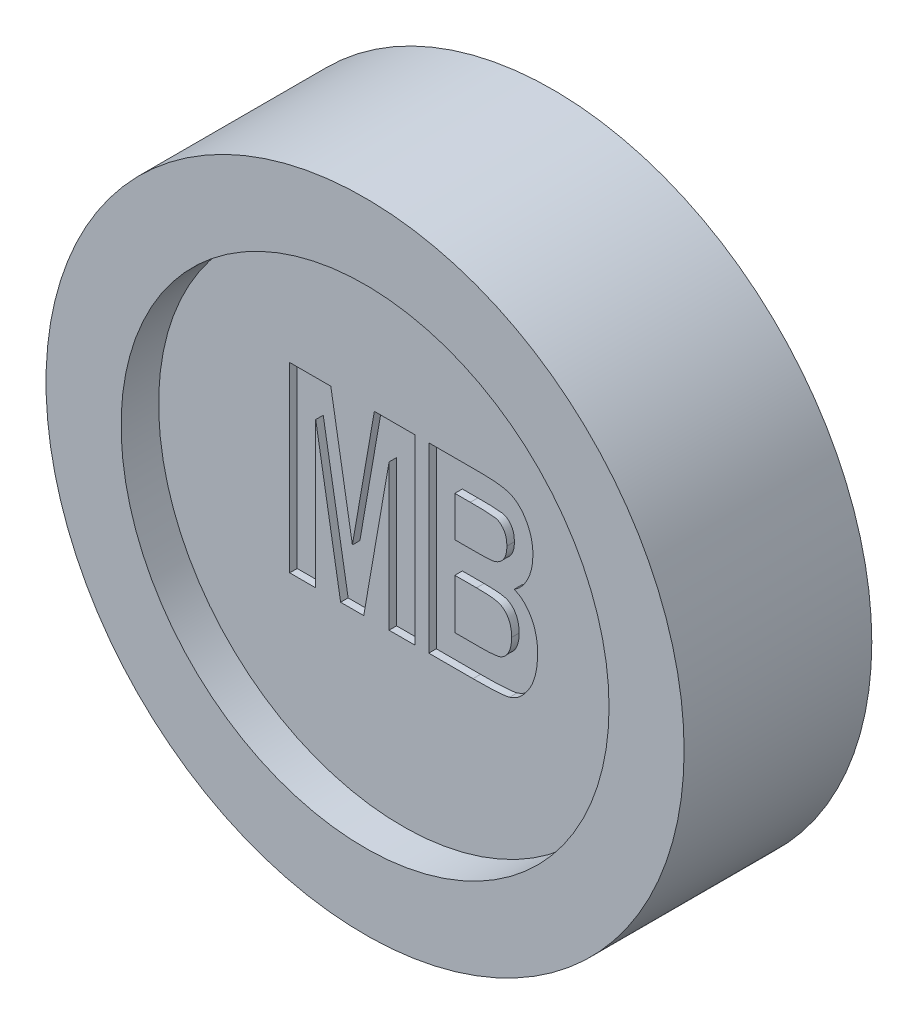
from build123d import *

# Parameters (mm, degrees)
SKETCH1_R           = 10.795
BOSS_EXTRUDE1_DEPTH = 6.35
SKETCH3_R           = 8.255
CUT_EXTRUDE1_DEPTH  = 1.27
CUT_EXTRUDE2_START  = -1.27
SKETCH4_R           = 8.255
CUT_EXTRUDE2_DEPTH  = 1.27
CUT_EXTRUDE3_DEPTH  = 0.254
CUT_EXTRUDE4_DEPTH  = 0.254
CUT_EXTRUDE5_DEPTH  = 0.254


with BuildPart() as part:
    # Sketch1 → Boss-Extrude1 (new body)
    with BuildSketch(Plane.XY):
        Circle(SKETCH1_R)
    extrude(amount=BOSS_EXTRUDE1_DEPTH)

    # Sketch3 → Cut-Extrude1 (cut)
    with BuildSketch(Plane.XY.offset(6.35)):
        Circle(SKETCH3_R)
    extrude(amount=-CUT_EXTRUDE1_DEPTH, mode=Mode.SUBTRACT)

    # Sketch4 → Cut-Extrude2 (cut)
    with BuildSketch(Plane(origin=(0, 0, 0), x_dir=(-1, 0, 0), z_dir=(0, 0, -1)).offset(CUT_EXTRUDE2_START)):
        with Locations(Location((0, 0, 0), (0, 0, 180))):
            Circle(SKETCH4_R)
    extrude(amount=CUT_EXTRUDE2_DEPTH, mode=Mode.SUBTRACT)

    # Sketch6 → Cut-Extrude3 (cut)
    # profile 1 of 2: a face of its own
    with BuildSketch(Plane.XY.offset(5.08)):
        Polygon((-3.820426287, -2.738134767), (-3.820426287, 3.425830077), (-2.429531623, 3.425830077), (-1.699061763, -0.859426326), (-0.956083858, 3.425830077), (0.422302761, 3.425830077), (0.422302761, -2.738134767), (-0.458263645, -2.738134767), (-0.458263645, 2.193787591), (-1.315064765, -2.738134767), (-2.096817611, -2.738134767), (-2.939859881, 2.193787591), (-2.939859881, -2.738134767), align=None)
    # profile 2 of 2: a face of its own
    with BuildSketch(Plane.XY.offset(5.08)):
        with BuildLine():
            Line((0.886601412, 3.425830077), (2.67400112, 3.425830077))
            add(Edge.make_bspline(
                [(2.67400112, 3.425830077), (2.732790269, 3.425222307), (2.845816799, 3.424053823), (3.008608251, 3.418759077), (3.157489236, 3.405767508), (3.292663768, 3.389668698), (3.414952449, 3.37065086), (3.523013921, 3.344272962), (3.618290449, 3.314681966), (3.727264663, 3.267991241), (3.85004685, 3.190422365), (3.982037051, 3.070723052), (4.10353071, 2.923641739), (4.208021503, 2.749583898), (4.299366262, 2.557436952), (4.361825053, 2.34817807), (4.402599544, 2.127000115), (4.406745433, 1.975086616), (4.408867037, 1.897346911)],
                knots=[0, 0, 0, 0, 1.056630108, 2.031450314, 2.926269266, 3.741363116, 4.47801298, 5.148632888, 5.738685924, 6.269003108, 7.275337549, 8.33132982, 9.459579192, 10.690726142, 11.971340976, 13.272571529, 14.604274901, 16, 16, 16, 16], degree=3))
            add(Edge.make_bspline(
                [(4.408867037, 1.897346911), (4.406663524, 1.825931891), (4.402335972, 1.685677612), (4.369489323, 1.480662376), (4.313978496, 1.286434243), (4.238374963, 1.105090113), (4.145432549, 0.940084936), (4.03708975, 0.796643491), (3.917277387, 0.672986409), (3.824277177, 0.610857104), (3.778461541, 0.580249716)],
                knots=[0, 0, 0, 0, 1.125723716, 2.210845361, 3.263765995, 4.303988308, 5.302058453, 6.240840838, 7.133367609, 8, 8, 8, 8], degree=3))
            add(Edge.make_bspline(
                [(3.778461541, 0.580249716), (3.838036291, 0.550581528), (3.957244452, 0.491215938), (4.115565373, 0.364834606), (4.249971486, 0.207534122), (4.365218869, 0.02529818), (4.458171491, -0.181603408), (4.521879622, -0.412343328), (4.563137981, -0.663235801), (4.566984104, -0.837988407), (4.56897002, -0.928220577)],
                knots=[0, 0, 0, 0, 0.883520627, 1.767911254, 2.672114911, 3.624549442, 4.627514094, 5.677337842, 6.80071118, 8, 8, 8, 8], degree=3))
            add(Edge.make_bspline(
                [(4.56897002, -0.928220577), (4.567801708, -0.98410484), (4.565514494, -1.093509906), (4.553681707, -1.254480975), (4.530265314, -1.408356699), (4.501437446, -1.556278288), (4.460841903, -1.696984384), (4.411747741, -1.83085644), (4.356006324, -1.959510377), (4.289538968, -2.079729075), (4.218036973, -2.191321339), (4.142100743, -2.291887234), (4.065478346, -2.382834837), (3.983005304, -2.460761424), (3.898125001, -2.528900039), (3.809369525, -2.585442707), (3.717145293, -2.629793374), (3.653625036, -2.651210227), (3.622110972, -2.661835689)],
                knots=[0, 0, 0, 0, 1.274453675, 2.495008106, 3.676776175, 4.82152406, 5.928871144, 7.011540481, 8.071389355, 9.122203498, 10.140077302, 11.090738677, 11.994017075, 12.847973492, 13.673462932, 14.472584156, 15.242208981, 16, 16, 16, 16], degree=3))
            add(Edge.make_bspline(
                [(3.622110972, -2.661835689), (3.596322402, -2.667963688), (3.537649713, -2.681905764), (3.437406333, -2.697750359), (3.314933526, -2.708868242), (3.171166685, -2.721013623), (3.005068264, -2.727207615), (2.817056551, -2.733959249), (2.606886823, -2.737455325), (2.459697318, -2.73790114), (2.382563659, -2.738134767)],
                knots=[0, 0, 0, 0, 0.51118732, 1.16302434, 1.955278967, 2.882990915, 3.945692945, 5.160771334, 6.512121516, 8, 8, 8, 8], degree=3))
            Line((2.382563659, -2.738134767), (0.886601412, -2.738134767))
            Line((0.886601412, -2.738134767), (0.886601412, 3.425830077))
        make_face()
        with BuildLine():
            Line((1.767167818, 2.385160688), (1.767167818, 1.024285333))
            Line((1.767167818, 1.024285333), (2.3663032, 1.024285333))
            add(Edge.make_bspline(
                [(2.3663032, 1.024285333), (2.40924854, 1.024141085), (2.490555091, 1.023867987), (2.606454485, 1.025690032), (2.709461693, 1.026221836), (2.799494059, 1.029319483), (2.876270327, 1.031068957), (2.940005582, 1.035415268), (2.991437818, 1.038237858), (3.021324154, 1.042470164), (3.034232832, 1.044298205)],
                knots=[0, 0, 0, 0, 1.541550462, 2.918550659, 4.160861091, 5.23886542, 6.152313063, 6.916924473, 7.532191829, 8, 8, 8, 8], degree=3))
            add(Edge.make_bspline(
                [(3.034232832, 1.044298205), (3.071315748, 1.052589669), (3.142882602, 1.068591485), (3.242138852, 1.113663006), (3.327766731, 1.17551248), (3.401125918, 1.253646175), (3.458274682, 1.348348232), (3.50038421, 1.458290205), (3.523147482, 1.583722878), (3.526527576, 1.672115067), (3.52830063, 1.71848186)],
                knots=[0, 0, 0, 0, 0.990046923, 1.910705777, 2.82302627, 3.731768384, 4.689453637, 5.692105556, 6.789376455, 8, 8, 8, 8], degree=3))
            add(Edge.make_bspline(
                [(3.52830063, 1.71848186), (3.527357282, 1.760272037), (3.525561959, 1.839804571), (3.505074611, 1.953061779), (3.471992949, 2.054368097), (3.423968655, 2.141954298), (3.367771673, 2.215654976), (3.306402783, 2.276393969), (3.237426833, 2.319655162), (3.173172862, 2.343887349), (3.110980537, 2.35720939), (3.045930318, 2.36302346), (2.96352265, 2.371613672), (2.863276463, 2.375077281), (2.745777913, 2.381275272), (2.610200937, 2.382389999), (2.456793921, 2.385987475), (2.348378134, 2.385445991), (2.291254926, 2.385160688)],
                knots=[0, 0, 0, 0, 1.212468739, 2.307497077, 3.329948461, 4.294465594, 5.193024313, 6.015226869, 6.787964824, 7.539148066, 7.997555292, 8.631430317, 9.433957082, 10.403932073, 11.543260838, 12.851317538, 14.340990295, 16, 16, 16, 16], degree=3))
            Line((2.291254926, 2.385160688), (1.767167818, 2.385160688))
        make_face(mode=Mode.SUBTRACT)
        with BuildLine():
            Line((1.767167818, -0.016384057), (1.767167818, -1.697465378))
            Line((1.767167818, -1.697465378), (2.607708479, -1.697465378))
            add(Edge.make_bspline(
                [(2.607708479, -1.697465378), (2.6519037, -1.697122127), (2.736131687, -1.696467954), (2.856251359, -1.694389964), (2.963861388, -1.689437362), (3.059034319, -1.682351638), (3.141549224, -1.672038809), (3.211925817, -1.661628408), (3.269535477, -1.64785666), (3.330785254, -1.628449836), (3.396042341, -1.590907708), (3.466422905, -1.53316408), (3.52993218, -1.458478088), (3.585426939, -1.368712796), (3.63205147, -1.264186938), (3.665311934, -1.145883117), (3.685546501, -1.014387801), (3.687423177, -0.92246133), (3.688403613, -0.874435981)],
                knots=[0, 0, 0, 0, 1.320687214, 2.516987601, 3.589599198, 4.539411053, 5.367707727, 6.074351137, 6.663612241, 7.136388901, 7.989518283, 8.892413061, 9.846464441, 10.904285711, 12.036457221, 13.254934037, 14.565889149, 16, 16, 16, 16], degree=3))
            add(Edge.make_bspline(
                [(3.688403613, -0.874435981), (3.687017206, -0.825146726), (3.684359505, -0.730660783), (3.662805998, -0.595903414), (3.628792567, -0.474061071), (3.577803744, -0.36728973), (3.517188766, -0.273805725), (3.444691195, -0.196580193), (3.363794951, -0.133685418), (3.286261549, -0.094970737), (3.215074189, -0.072071588), (3.148812318, -0.057619623), (3.070915976, -0.043487369), (2.98010433, -0.03473373), (2.877639537, -0.024984441), (2.762816516, -0.021334653), (2.635677625, -0.016832014), (2.546842061, -0.01653841), (2.500139287, -0.016384057)],
                knots=[0, 0, 0, 0, 1.373669901, 2.633281717, 3.795906759, 4.888093828, 5.919952209, 6.890587465, 7.827709407, 8.763604513, 9.289363045, 9.909817155, 10.653352002, 11.495593405, 12.452413331, 13.523038871, 14.697808051, 16, 16, 16, 16], degree=3))
            Line((2.500139287, -0.016384057), (1.767167818, -0.016384057))
        make_face(mode=Mode.SUBTRACT)
    extrude(amount=-CUT_EXTRUDE3_DEPTH, mode=Mode.SUBTRACT)

    # Sketch7 → Cut-Extrude4 (cut)
    # profile 1 of 7: a face of its own
    with BuildSketch(Plane(origin=(0, 0, 1.27), x_dir=(-1, 0, 0), z_dir=(0, 0, -1))):
        with BuildLine():
            Line((-4.038542671, 0.668932871), (-3.598259468, 0.485481536))
            add(Edge.make_bspline(
                [(-3.598259468, 0.485481536), (-3.607352571, 0.448471677), (-3.625070932, 0.376356138), (-3.658591631, 0.273282764), (-3.695477329, 0.177646371), (-3.737676639, 0.089982274), (-3.783742764, 0.009521362), (-3.834912856, -0.062944597), (-3.890224198, -0.127786635), (-3.949991386, -0.184853242), (-4.014117491, -0.233954497), (-4.080802019, -0.2777087), (-4.151766959, -0.313577827), (-4.226018611, -0.343863785), (-4.304140728, -0.366376362), (-4.385539757, -0.383318008), (-4.470565082, -0.393012807), (-4.528486875, -0.394386412), (-4.557939262, -0.39508487)],
                knots=[0, 0, 0, 0, 1.282586353, 2.499182829, 3.646034602, 4.730797578, 5.771318175, 6.763713287, 7.712684321, 8.6363956, 9.539720391, 10.428356747, 11.317388874, 12.212151588, 13.124116906, 14.050177375, 15.008543639, 16, 16, 16, 16], degree=3))
            add(Edge.make_bspline(
                [(-4.557939262, -0.39508487), (-4.594893041, -0.394254058), (-4.667284622, -0.392626517), (-4.772917849, -0.375114583), (-4.873436965, -0.34850825), (-4.968660776, -0.310301388), (-5.0587022, -0.261464884), (-5.142610026, -0.200973701), (-5.22234217, -0.131079822), (-5.26870092, -0.076583195), (-5.292317886, -0.048820476)],
                knots=[0, 0, 0, 0, 1.053414494, 2.063614103, 3.046293227, 4.01520277, 4.983805463, 5.961130836, 6.961320097, 8, 8, 8, 8], degree=3))
            add(Edge.make_bspline(
                [(-5.292317886, -0.048820476), (-5.318277676, -0.014543914), (-5.370576074, 0.054509387), (-5.436233808, 0.168378158), (-5.492076972, 0.290711015), (-5.537781847, 0.421618837), (-5.573406388, 0.561246654), (-5.598312568, 0.709661033), (-5.613269488, 0.866790185), (-5.61522433, 0.974460565), (-5.616224149, 1.029529401)],
                knots=[0, 0, 0, 0, 0.898140554, 1.809387162, 2.740718204, 3.705966939, 4.703925369, 5.74945803, 6.848943185, 8, 8, 8, 8], degree=3))
            add(Edge.make_bspline(
                [(-5.616224149, 1.029529401), (-5.615310742, 1.087662341), (-5.613531579, 1.200895555), (-5.59751291, 1.365752351), (-5.573093136, 1.521173073), (-5.536684266, 1.666580048), (-5.491074136, 1.802808214), (-5.434722953, 1.929008071), (-5.369293574, 2.046499476), (-5.315910679, 2.116669307), (-5.289451459, 2.151448969)],
                knots=[0, 0, 0, 0, 1.171098873, 2.281104103, 3.334483992, 4.338438261, 5.297974877, 6.225356982, 7.120398547, 8, 8, 8, 8], degree=3))
            add(Edge.make_bspline(
                [(-5.289451459, 2.151448969), (-5.265427794, 2.179562842), (-5.218082303, 2.234969254), (-5.137157596, 2.306716666), (-5.050219054, 2.367704521), (-4.957298134, 2.417638082), (-4.85797905, 2.456474776), (-4.752747894, 2.483878553), (-4.64118334, 2.500047879), (-4.564872317, 2.502296124), (-4.525835278, 2.503446217)],
                knots=[0, 0, 0, 0, 1.017460211, 2.005195831, 2.96880208, 3.936538458, 4.903086366, 5.898753713, 6.925103759, 8, 8, 8, 8], degree=3))
            add(Edge.make_bspline(
                [(-4.525835278, 2.503446217), (-4.49388874, 2.502681535), (-4.431099318, 2.501178587), (-4.339030015, 2.489163344), (-4.251311369, 2.46803622), (-4.167087117, 2.440324025), (-4.087096199, 2.403245394), (-4.011107318, 2.358252639), (-3.938821645, 2.305493682), (-3.895008156, 2.264478516), (-3.872863184, 2.243747922)],
                knots=[0, 0, 0, 0, 1.062174293, 2.087653736, 3.080296642, 4.058948008, 5.03139012, 6.005719887, 6.992016441, 8, 8, 8, 8], degree=3))
            add(Edge.make_bspline(
                [(-3.872863184, 2.243747922), (-3.857466, 2.227770479), (-3.826090869, 2.195212943), (-3.783844184, 2.140371808), (-3.744731084, 2.079974926), (-3.709452826, 2.013764551), (-3.676655749, 1.942387816), (-3.646832808, 1.865478848), (-3.620596928, 1.78286268), (-3.605820316, 1.725573754), (-3.598259468, 1.696260345)],
                knots=[0, 0, 0, 0, 0.858002413, 1.748367619, 2.673305357, 3.63929672, 4.648357542, 5.711115493, 6.828831091, 8, 8, 8, 8], degree=3))
            Line((-3.598259468, 1.696260345), (-4.038542671, 1.549499277))
            add(Edge.make_bspline(
                [(-4.038542671, 1.549499277), (-4.042679988, 1.568289993), (-4.050730521, 1.604853606), (-4.066893944, 1.657619874), (-4.086572264, 1.706629252), (-4.107982535, 1.753058277), (-4.133764065, 1.795301043), (-4.160732357, 1.835375934), (-4.192355205, 1.870880734), (-4.225763869, 1.90368108), (-4.262136766, 1.932026016), (-4.299367695, 1.957659589), (-4.338566653, 1.978972026), (-4.379570132, 1.996112582), (-4.42189248, 2.009984474), (-4.465849064, 2.019739529), (-4.511339287, 2.025646859), (-4.542251428, 2.026194713), (-4.557939262, 2.026472747)],
                knots=[0, 0, 0, 0, 1.200071046, 2.335138942, 3.437621639, 4.493482591, 5.51985659, 6.521917265, 7.50210956, 8.480124453, 9.438987346, 10.374745328, 11.297656865, 12.216555725, 13.143999084, 14.072438006, 15.021767148, 16, 16, 16, 16], degree=3))
            add(Edge.make_bspline(
                [(-4.557939262, 2.026472747), (-4.58014144, 2.025814478), (-4.623837598, 2.024518936), (-4.687856232, 2.014211339), (-4.748426556, 1.995980077), (-4.80646048, 1.972046021), (-4.860982814, 1.94015873), (-4.912600522, 1.901542772), (-4.959925657, 1.855031145), (-5.005281807, 1.802713547), (-5.046382154, 1.742097035), (-5.081279154, 1.672040466), (-5.110062845, 1.592793942), (-5.1348566, 1.504925813), (-5.153406889, 1.407858777), (-5.166280218, 1.301743148), (-5.174314627, 1.186732813), (-5.175386372, 1.106936729), (-5.175940945, 1.065646382)],
                knots=[0, 0, 0, 0, 0.827686898, 1.628972485, 2.409099021, 3.181967192, 3.964173723, 4.757978677, 5.579415306, 6.433460257, 7.33665582, 8.302235029, 9.343905073, 10.476376866, 11.703364719, 13.024698166, 14.460435141, 16, 16, 16, 16], degree=3))
            add(Edge.make_bspline(
                [(-5.175940945, 1.065646382), (-5.175314306, 1.022833167), (-5.174107589, 0.94038788), (-5.167073397, 0.82130925), (-5.153703067, 0.711903263), (-5.13658803, 0.611739729), (-5.113167704, 0.52140411), (-5.084555254, 0.440841079), (-5.051598262, 0.369264128), (-5.012284106, 0.307612358), (-4.968723242, 0.254388525), (-4.922410078, 0.208178642), (-4.872450486, 0.169576715), (-4.820181015, 0.136861803), (-4.764166659, 0.112071311), (-4.705070089, 0.095204416), (-4.643241788, 0.083538403), (-4.600800525, 0.082445898), (-4.579150822, 0.0818886)],
                knots=[0, 0, 0, 0, 1.588381619, 3.058741945, 4.422565575, 5.675514383, 6.825848758, 7.879737597, 8.8437938, 9.742560847, 10.584031071, 11.391113559, 12.163968987, 12.921455088, 13.673648094, 14.427376256, 15.197789283, 16, 16, 16, 16], degree=3))
            add(Edge.make_bspline(
                [(-4.579150822, 0.0818886), (-4.563272593, 0.082380358), (-4.531774634, 0.083355869), (-4.485425115, 0.089567636), (-4.440698607, 0.100674159), (-4.397589076, 0.116083201), (-4.356280256, 0.136413463), (-4.316348318, 0.16049892), (-4.278599934, 0.189449901), (-4.242055627, 0.222322317), (-4.207587751, 0.260131406), (-4.176086747, 0.303601208), (-4.146818754, 0.351954806), (-4.119960711, 0.405492085), (-4.095341323, 0.463868948), (-4.073634262, 0.527533369), (-4.053991387, 0.596167503), (-4.043791431, 0.644210561), (-4.038542671, 0.668932871)],
                knots=[0, 0, 0, 0, 0.874040642, 1.73385169, 2.568061146, 3.406503852, 4.248567505, 5.09821747, 5.96915136, 6.862782357, 7.800986125, 8.779254107, 9.812897901, 10.908933612, 12.073249979, 13.297367906, 14.609261928, 16, 16, 16, 16], degree=3))
        make_face()
    # profile 2 of 7: a face of its own
    with BuildSketch(Plane(origin=(0, 0, 1.27), x_dir=(-1, 0, 0), z_dir=(0, 0, -1))):
        with BuildLine():
            add(Edge.make_bspline(
                [(-3.521209907, 0.697597142), (-3.519842489, 0.746418457), (-3.517151751, 0.842486679), (-3.494014864, 0.982808314), (-3.457630744, 1.116746616), (-3.413714807, 1.221974233), (-3.3725417, 1.301456576), (-3.339317412, 1.357236982), (-3.303551624, 1.409018453), (-3.266051869, 1.457084397), (-3.225855608, 1.501191076), (-3.183943877, 1.541680273), (-3.13921986, 1.578237564), (-3.076953207, 1.62141552), (-2.994128396, 1.6665695), (-2.888082961, 1.705194975), (-2.776043507, 1.729031438), (-2.699237563, 1.731628455), (-2.660135205, 1.732950612)],
                knots=[0, 0, 0, 0, 1.556681502, 3.063162581, 4.524556931, 5.976049118, 6.690484325, 7.379521108, 8.045822696, 8.697116328, 9.322943537, 9.94817653, 10.554730816, 11.163578782, 12.36395075, 13.552075371, 14.75374718, 16, 16, 16, 16], degree=3))
            add(Edge.make_bspline(
                [(-2.660135205, 1.732950612), (-2.627410985, 1.731891923), (-2.563361246, 1.729819797), (-2.469917452, 1.715591172), (-2.382059421, 1.690626759), (-2.299301825, 1.656394914), (-2.222750763, 1.6108643), (-2.150810384, 1.556860583), (-2.085307274, 1.491799421), (-2.025800756, 1.418140452), (-1.972283274, 1.33810162), (-1.925201495, 1.253971372), (-1.885750895, 1.166378863), (-1.852326419, 1.07601054), (-1.828350642, 0.981501623), (-1.809710537, 0.884128621), (-1.798566558, 0.783276088), (-1.797372744, 0.715014176), (-1.796767361, 0.680398579)],
                knots=[0, 0, 0, 0, 1.032054068, 2.019995973, 2.972061934, 3.906723031, 4.836005299, 5.773828533, 6.737027708, 7.73951492, 8.755857002, 9.770356733, 10.776442903, 11.783124641, 12.804973846, 13.847568463, 14.908502576, 16, 16, 16, 16], degree=3))
            add(Edge.make_bspline(
                [(-1.796767361, 0.680398579), (-1.797034495, 0.65458811), (-1.79756351, 0.603474668), (-1.803702518, 0.527735786), (-1.812521547, 0.453806841), (-1.825913129, 0.381670171), (-1.84291047, 0.311603084), (-1.863934225, 0.243399517), (-1.887588857, 0.176922311), (-1.915927591, 0.113044689), (-1.946434473, 0.051713132), (-1.980549444, -0.005352475), (-2.015825027, -0.0592736), (-2.054672981, -0.108302867), (-2.094551338, -0.154712922), (-2.137735533, -0.196456945), (-2.1830811, -0.234493891), (-2.246118915, -0.279168783), (-2.328972505, -0.325482524), (-2.434368616, -0.365575028), (-2.544502742, -0.390571974), (-2.619875413, -0.39357313), (-2.657842063, -0.39508487)],
                knots=[0, 0, 0, 0, 1.007877983, 1.995938637, 2.966162127, 3.914814336, 4.859789072, 5.780608151, 6.70142723, 7.613889557, 8.508470822, 9.375089484, 10.209347433, 11.023051667, 11.81647726, 12.597661281, 13.366010139, 14.126084987, 15.612979557, 17.05878539, 18.518454158, 20, 20, 20, 20], degree=3))
            add(Edge.make_bspline(
                [(-2.657842063, -0.39508487), (-2.688272367, -0.394182628), (-2.748087256, -0.392409148), (-2.835810943, -0.379038066), (-2.919386594, -0.356557732), (-2.999022586, -0.325468183), (-3.074783328, -0.285485433), (-3.146766386, -0.236745849), (-3.213917639, -0.177932394), (-3.277571828, -0.111949155), (-3.335172586, -0.037150959), (-3.384796495, 0.045792154), (-3.427771545, 0.135836576), (-3.461725137, 0.233841155), (-3.488835095, 0.339069586), (-3.507308054, 0.452084415), (-3.518937191, 0.572377036), (-3.520439431, 0.655146112), (-3.521209907, 0.697597142)],
                knots=[0, 0, 0, 0, 0.932512926, 1.832980627, 2.712496059, 3.580506363, 4.447765331, 5.333190401, 6.238540988, 7.178967574, 8.139661075, 9.125124005, 10.136480502, 11.192447616, 12.299149515, 13.463368684, 14.698999463, 16, 16, 16, 16], degree=3))
        make_face()
        with BuildLine():
            add(Edge.make_bspline(
                [(-3.080926704, 0.668932871), (-3.080724326, 0.644074357), (-3.080331306, 0.595798684), (-3.073646924, 0.525754884), (-3.063982136, 0.460300284), (-3.051398252, 0.399270256), (-3.033060917, 0.343339735), (-3.012372754, 0.291581156), (-2.986892478, 0.244702221), (-2.957735771, 0.202875209), (-2.925430765, 0.166150768), (-2.891520023, 0.134113411), (-2.856676204, 0.105793508), (-2.818966634, 0.084336722), (-2.780269688, 0.066759055), (-2.740075084, 0.054143292), (-2.698087787, 0.046299777), (-2.669533882, 0.045570272), (-2.654975636, 0.045198333)],
                knots=[0, 0, 0, 0, 1.413435947, 2.744917549, 3.997764295, 5.176762478, 6.28365779, 7.341374166, 8.343333232, 9.311285103, 10.235656245, 11.119850599, 11.963565454, 12.781974458, 13.579916342, 14.377487969, 15.172760151, 16, 16, 16, 16], degree=3))
            add(Edge.make_bspline(
                [(-2.654975636, 0.045198333), (-2.640800039, 0.04557993), (-2.61281758, 0.046333198), (-2.57158592, 0.054149347), (-2.532135413, 0.066696701), (-2.494187237, 0.084214249), (-2.457910767, 0.106859332), (-2.42302522, 0.134261498), (-2.390105478, 0.1670302), (-2.358648164, 0.20396768), (-2.329849115, 0.246120517), (-2.304464976, 0.293050019), (-2.284371821, 0.345347787), (-2.266057835, 0.401387356), (-2.253401881, 0.462778561), (-2.243582771, 0.528593238), (-2.237851418, 0.599272969), (-2.237322798, 0.647902242), (-2.237050565, 0.672945869)],
                knots=[0, 0, 0, 0, 0.808000523, 1.59498332, 2.384605109, 3.165141781, 3.972995168, 4.819296264, 5.690514241, 6.61887202, 7.583588115, 8.598212565, 9.655073588, 10.775752316, 11.958364484, 13.22583637, 14.571331316, 16, 16, 16, 16], degree=3))
            add(Edge.make_bspline(
                [(-2.237050565, 0.672945869), (-2.237252992, 0.697422491), (-2.23764594, 0.744935828), (-2.244321184, 0.813834942), (-2.25403588, 0.878331603), (-2.266631799, 0.93857855), (-2.284730333, 0.994122132), (-2.306456827, 1.045128604), (-2.331578946, 1.092058209), (-2.360991889, 1.133895122), (-2.392942106, 1.17089293), (-2.426451135, 1.20341447), (-2.461411262, 1.231199716), (-2.49822839, 1.253652622), (-2.536579306, 1.271049618), (-2.576340836, 1.2838177), (-2.617986541, 1.291514922), (-2.64634401, 1.292279906), (-2.66070849, 1.292667409)],
                knots=[0, 0, 0, 0, 1.402767332, 2.723012804, 3.964152086, 5.141819357, 6.247084086, 7.307339051, 8.317264307, 9.29291199, 10.232905452, 11.116215361, 11.966638267, 12.787762059, 13.582061217, 14.375528767, 15.177123852, 16, 16, 16, 16], degree=3))
            add(Edge.make_bspline(
                [(-2.66070849, 1.292667409), (-2.674883235, 1.292283881), (-2.702864009, 1.291526803), (-2.744108064, 1.283738693), (-2.783677468, 1.271032232), (-2.821949385, 1.253811935), (-2.858365455, 1.231013003), (-2.893228916, 1.203413642), (-2.926793057, 1.17107926), (-2.958016091, 1.133655942), (-2.9878804, 1.092155235), (-3.011715326, 1.044456023), (-3.034232571, 0.993561421), (-3.050887987, 0.937195368), (-3.064974362, 0.87677575), (-3.073393902, 0.811271559), (-3.080388826, 0.741697979), (-3.08074433, 0.693604728), (-3.080926704, 0.668932871)],
                knots=[0, 0, 0, 0, 0.81048791, 1.599893392, 2.39194599, 3.184828714, 3.995169034, 4.844075423, 5.725810169, 6.657025848, 7.630933707, 8.643556476, 9.70192074, 10.812346547, 12.000966443, 13.249126104, 14.58880056, 16, 16, 16, 16], degree=3))
        make_face(mode=Mode.SUBTRACT)
    # profile 3 of 7: a face of its own
    with BuildSketch(Plane(origin=(0, 0, 1.27), x_dir=(-1, 0, 0), z_dir=(0, 0, -1))):
        with BuildLine():
            Line((-0.142036323, -0.358394603), (-0.582319526, -0.358394603))
            Line((-0.582319526, -0.358394603), (-0.582319526, 0.691864288))
            add(Edge.make_bspline(
                [(-0.582319526, 0.691864288), (-0.582457029, 0.717089526), (-0.582719548, 0.765249326), (-0.583935242, 0.834235696), (-0.585386447, 0.896746883), (-0.588345871, 0.952738955), (-0.591745317, 1.002050247), (-0.595485444, 1.044738876), (-0.600620752, 1.080686513), (-0.60794506, 1.11927759), (-0.620433696, 1.160668997), (-0.640353725, 1.204669895), (-0.665717249, 1.242894504), (-0.697060388, 1.273696231), (-0.731456798, 1.298580051), (-0.768432183, 1.316651582), (-0.807966399, 1.327503477), (-0.835070305, 1.328731305), (-0.848897247, 1.329357676)],
                knots=[0, 0, 0, 0, 1.564175935, 2.986310732, 4.278392903, 5.441152144, 6.462684336, 7.343460083, 8.097556224, 8.713387156, 9.777995297, 10.769464538, 11.699554187, 12.604469556, 13.479166502, 14.321813511, 15.143880364, 16, 16, 16, 16], degree=3))
            add(Edge.make_bspline(
                [(-0.848897247, 1.329357676), (-0.866771636, 1.328527276), (-0.902112652, 1.326885421), (-0.953381958, 1.312119502), (-1.002435651, 1.289841396), (-1.047246199, 1.257246637), (-1.088474139, 1.217787063), (-1.122698477, 1.170104547), (-1.151397443, 1.116086372), (-1.168644737, 1.064993564), (-1.180156603, 1.018386738), (-1.186415067, 0.975530681), (-1.193092388, 0.925908716), (-1.19706185, 0.869030565), (-1.201358802, 0.805230024), (-1.204015417, 0.73430533), (-1.205769218, 0.656329827), (-1.205956484, 0.602050773), (-1.206054064, 0.573767491)],
                knots=[0, 0, 0, 0, 0.912260912, 1.803710673, 2.708823907, 3.655207425, 4.622800071, 5.615822843, 6.643167931, 7.740420572, 8.363838167, 9.096499661, 9.953534309, 10.92423146, 12.011207721, 13.22406492, 14.553538633, 16, 16, 16, 16], degree=3))
            Line((-1.206054064, 0.573767491), (-1.206054064, -0.358394603))
            Line((-1.206054064, -0.358394603), (-1.646337267, -0.358394603))
            Line((-1.646337267, -0.358394603), (-1.646337267, 1.696260345))
            Line((-1.646337267, 1.696260345), (-1.242744331, 1.696260345))
            Line((-1.242744331, 1.696260345), (-1.242744331, 1.395285499))
            add(Edge.make_bspline(
                [(-1.242744331, 1.395285499), (-1.224766267, 1.422071562), (-1.189863659, 1.474074017), (-1.129948034, 1.542853199), (-1.067109473, 1.601547915), (-1.000816353, 1.649958195), (-0.930172482, 1.686898732), (-0.856117505, 1.713409552), (-0.778376476, 1.730287407), (-0.725154427, 1.73205358), (-0.698123181, 1.732950612)],
                knots=[0, 0, 0, 0, 1.153503468, 2.239411313, 3.255599344, 4.225448284, 5.167561241, 6.097684997, 7.033822547, 8, 8, 8, 8], degree=3))
            add(Edge.make_bspline(
                [(-0.698123181, 1.732950612), (-0.667251437, 1.73183529), (-0.607558113, 1.729678715), (-0.521641307, 1.710260702), (-0.443435145, 1.678111107), (-0.373765161, 1.633154318), (-0.312316687, 1.579722402), (-0.261314291, 1.517227295), (-0.219967988, 1.44805758), (-0.195577205, 1.383999995), (-0.179624885, 1.328759191), (-0.169535585, 1.282381835), (-0.160829807, 1.231510162), (-0.154338433, 1.176173306), (-0.148420238, 1.116564037), (-0.14452361, 1.05250534), (-0.142217752, 0.984066565), (-0.142097921, 0.936850221), (-0.142036323, 0.912579175)],
                knots=[0, 0, 0, 0, 1.308938681, 2.530951974, 3.716428407, 4.879748636, 6.034981781, 7.158690022, 8.289634892, 9.440388768, 10.056515484, 10.729544994, 11.453620819, 12.246399611, 13.093849248, 13.995974801, 14.969852725, 16, 16, 16, 16], degree=3))
            Line((-0.142036323, 0.912579175), (-0.142036323, -0.358394603))
        make_face()
    # profile 4 of 7: a face of its own
    with BuildSketch(Plane(origin=(0, 0, 1.27), x_dir=(-1, 0, 0), z_dir=(0, 0, -1))):
        with BuildLine():
            Line((1.622765516, -0.358394603), (1.182482313, -0.358394603))
            Line((1.182482313, -0.358394603), (1.182482313, 0.691864288))
            add(Edge.make_bspline(
                [(1.182482313, 0.691864288), (1.18234481, 0.717089526), (1.182082291, 0.765249326), (1.180866598, 0.834235696), (1.179415392, 0.896746883), (1.176455968, 0.952738955), (1.173056522, 1.002050247), (1.169316395, 1.044738876), (1.164181087, 1.080686513), (1.156856779, 1.11927759), (1.144368143, 1.160668997), (1.124448115, 1.204669895), (1.09908459, 1.242894504), (1.067741451, 1.273696231), (1.033345041, 1.298580051), (0.996369656, 1.316651582), (0.95683544, 1.327503477), (0.929731534, 1.328731305), (0.915904592, 1.329357676)],
                knots=[0, 0, 0, 0, 1.564175935, 2.986310732, 4.278392903, 5.441152144, 6.462684336, 7.343460083, 8.097556224, 8.713387156, 9.777995297, 10.769464538, 11.699554187, 12.604469556, 13.479166502, 14.321813511, 15.143880364, 16, 16, 16, 16], degree=3))
            add(Edge.make_bspline(
                [(0.915904592, 1.329357676), (0.898030203, 1.328527276), (0.862689188, 1.326885421), (0.811419882, 1.312119502), (0.762366188, 1.289841396), (0.71755564, 1.257246637), (0.6763277, 1.217787063), (0.642103363, 1.170104547), (0.613404396, 1.116086372), (0.596157102, 1.064993564), (0.584645236, 1.018386738), (0.578386772, 0.975530681), (0.571709451, 0.925908716), (0.567739989, 0.869030565), (0.563443037, 0.805230024), (0.560786423, 0.73430533), (0.559032622, 0.656329827), (0.558845355, 0.602050773), (0.558747775, 0.573767491)],
                knots=[0, 0, 0, 0, 0.912260912, 1.803710673, 2.708823907, 3.655207425, 4.622800071, 5.615822843, 6.643167931, 7.740420572, 8.363838167, 9.096499661, 9.953534309, 10.92423146, 12.011207721, 13.22406492, 14.553538633, 16, 16, 16, 16], degree=3))
            Line((0.558747775, 0.573767491), (0.558747775, -0.358394603))
            Line((0.558747775, -0.358394603), (0.118464572, -0.358394603))
            Line((0.118464572, -0.358394603), (0.118464572, 1.696260345))
            Line((0.118464572, 1.696260345), (0.522057508, 1.696260345))
            Line((0.522057508, 1.696260345), (0.522057508, 1.395285499))
            add(Edge.make_bspline(
                [(0.522057508, 1.395285499), (0.540035572, 1.422071562), (0.57493818, 1.474074017), (0.634853805, 1.542853199), (0.697692366, 1.601547915), (0.763985486, 1.649958195), (0.834629357, 1.686898732), (0.908684334, 1.713409552), (0.986425363, 1.730287407), (1.039647412, 1.73205358), (1.066678658, 1.732950612)],
                knots=[0, 0, 0, 0, 1.153503468, 2.239411313, 3.255599344, 4.225448284, 5.167561241, 6.097684997, 7.033822547, 8, 8, 8, 8], degree=3))
            add(Edge.make_bspline(
                [(1.066678658, 1.732950612), (1.097550402, 1.73183529), (1.157243726, 1.729678715), (1.243160532, 1.710260702), (1.321366694, 1.678111107), (1.391036678, 1.633154318), (1.452485152, 1.579722402), (1.503487548, 1.517227295), (1.544833851, 1.44805758), (1.569224634, 1.383999995), (1.585176954, 1.328759191), (1.595266254, 1.282381835), (1.603972032, 1.231510162), (1.610463406, 1.176173306), (1.616381601, 1.116564037), (1.620278229, 1.05250534), (1.622584087, 0.984066565), (1.622703918, 0.936850221), (1.622765516, 0.912579175)],
                knots=[0, 0, 0, 0, 1.308938681, 2.530951974, 3.716428407, 4.879748636, 6.034981781, 7.158690022, 8.289634892, 9.440388768, 10.056515484, 10.729544994, 11.453620819, 12.246399611, 13.093849248, 13.995974801, 14.969852725, 16, 16, 16, 16], degree=3))
            Line((1.622765516, 0.912579175), (1.622765516, -0.358394603))
        make_face()
    # profile 5 of 7: a face of its own
    with BuildSketch(Plane(origin=(0, 0, 1.27), x_dir=(-1, 0, 0), z_dir=(0, 0, -1))):
        with BuildLine():
            Line((2.873903618, 0.302030202), (3.314186822, 0.228649668))
            add(Edge.make_bspline(
                [(3.314186822, 0.228649668), (3.306698274, 0.202929946), (3.292073241, 0.152699674), (3.264850902, 0.081030678), (3.235132983, 0.014339521), (3.202546512, -0.047379011), (3.166364338, -0.103680279), (3.127088881, -0.154900941), (3.085579872, -0.201837188), (3.039726666, -0.242287901), (2.992203454, -0.278931388), (2.941297272, -0.309887029), (2.888186286, -0.336231394), (2.832348351, -0.357758122), (2.774136451, -0.37411295), (2.713395164, -0.386215008), (2.650142073, -0.393984795), (2.606966817, -0.394713549), (2.584967766, -0.39508487)],
                knots=[0, 0, 0, 0, 1.232714057, 2.407474081, 3.525740945, 4.592223854, 5.617079511, 6.602360518, 7.561574953, 8.495942672, 9.412584555, 10.320830318, 11.233538188, 12.138583263, 13.071417567, 14.013373849, 14.987756094, 16, 16, 16, 16], degree=3))
            add(Edge.make_bspline(
                [(2.584967766, -0.39508487), (2.554930529, -0.394299441), (2.49634892, -0.392767619), (2.411007882, -0.381276999), (2.330916678, -0.361736495), (2.25602697, -0.334884797), (2.186405818, -0.300262049), (2.122364184, -0.257421864), (2.06332359, -0.206848813), (2.029004632, -0.167739195), (2.011682346, -0.147998854)],
                knots=[0, 0, 0, 0, 1.115161021, 2.174897944, 3.190304242, 4.171206351, 5.123219486, 6.069849103, 7.025768057, 8, 8, 8, 8], degree=3))
            add(Edge.make_bspline(
                [(2.011682346, -0.147998854), (1.992625059, -0.123139528), (1.954114047, -0.072903741), (1.905263077, 0.010284866), (1.864930094, 0.100925661), (1.830609228, 0.198158724), (1.805431273, 0.303150943), (1.786304395, 0.414951364), (1.775688463, 0.534006952), (1.77404102, 0.615597711), (1.773195611, 0.657467163)],
                knots=[0, 0, 0, 0, 0.876816242, 1.771872474, 2.694187044, 3.652337651, 4.655867876, 5.714487856, 6.827157152, 8, 8, 8, 8], degree=3))
            add(Edge.make_bspline(
                [(1.773195611, 0.657467163), (1.774025751, 0.698957984), (1.775643078, 0.779792729), (1.786497968, 0.898035022), (1.805137386, 1.010047165), (1.83225163, 1.115563357), (1.865930782, 1.215151227), (1.907845226, 1.308012552), (1.957150477, 1.395003142), (1.996234767, 1.448007385), (2.015695344, 1.474398887)],
                knots=[0, 0, 0, 0, 1.146796484, 2.234253234, 3.278893813, 4.281992692, 5.242465425, 6.181018207, 7.094305297, 8, 8, 8, 8], degree=3))
            add(Edge.make_bspline(
                [(2.015695344, 1.474398887), (2.032977623, 1.495120225), (2.066830501, 1.5357096), (2.125132924, 1.587730635), (2.185770594, 1.633329184), (2.251322729, 1.669209319), (2.319836605, 1.698597773), (2.392611271, 1.718267442), (2.468919402, 1.730800484), (2.521091013, 1.732224307), (2.547704214, 1.732950612)],
                knots=[0, 0, 0, 0, 1.054423228, 2.065425522, 3.04949579, 4.016891036, 4.982058557, 5.959887573, 6.959320554, 8, 8, 8, 8], degree=3))
            add(Edge.make_bspline(
                [(2.547704214, 1.732950612), (2.577188502, 1.732298852), (2.634722724, 1.731027038), (2.718366693, 1.71763908), (2.797448756, 1.698179187), (2.87155634, 1.669127031), (2.940651568, 1.631722186), (3.004683548, 1.586030145), (3.063865733, 1.532371603), (3.098328691, 1.491262425), (3.115830066, 1.470385889)],
                knots=[0, 0, 0, 0, 1.088682434, 2.124402561, 3.12298092, 4.093444635, 5.057230266, 6.019384489, 6.994181053, 8, 8, 8, 8], degree=3))
            add(Edge.make_bspline(
                [(3.115830066, 1.470385889), (3.135015036, 1.444243934), (3.174154504, 1.390911443), (3.221730465, 1.301121654), (3.262361244, 1.203125764), (3.296528134, 1.09643833), (3.321781548, 0.980430677), (3.339703461, 0.855694502), (3.351692782, 0.722290128), (3.352667471, 0.63035935), (3.35317023, 0.582940058)],
                knots=[0, 0, 0, 0, 0.831163965, 1.695666726, 2.599069064, 3.551260179, 4.566077474, 5.641675786, 6.783540543, 8, 8, 8, 8], degree=3))
            Line((3.35317023, 0.582940058), (3.350877088, 0.522171803))
            Line((3.350877088, 0.522171803), (2.213478814, 0.522171803))
            add(Edge.make_bspline(
                [(2.213478814, 0.522171803), (2.214224912, 0.502286299), (2.2156769, 0.463586959), (2.221273309, 0.407245854), (2.230467938, 0.354600853), (2.242453983, 0.305281847), (2.257825055, 0.259366492), (2.276699767, 0.216970985), (2.298728205, 0.177954715), (2.323788068, 0.142681239), (2.351129662, 0.111232254), (2.380300519, 0.084005487), (2.410180934, 0.060222229), (2.442552166, 0.041889524), (2.475561426, 0.026646849), (2.510359811, 0.016500753), (2.54630575, 0.009867558), (2.570796531, 0.008966284), (2.58324791, 0.008508066)],
                knots=[0, 0, 0, 0, 1.35591678, 2.638760514, 3.854825, 4.995029552, 6.094573698, 7.149727403, 8.152807325, 9.142869075, 10.093520324, 10.987160547, 11.859773256, 12.688425387, 13.516156053, 14.33191691, 15.15192844, 16, 16, 16, 16], degree=3))
            add(Edge.make_bspline(
                [(2.58324791, 0.008508066), (2.600734287, 0.009327693), (2.634759371, 0.010922528), (2.683431213, 0.025186408), (2.72738204, 0.048751239), (2.766964892, 0.081302809), (2.800885598, 0.123877419), (2.830866223, 0.174699227), (2.855268606, 0.235165445), (2.867473922, 0.278959646), (2.873903618, 0.302030202)],
                knots=[0, 0, 0, 0, 0.932193119, 1.813866296, 2.681250778, 3.580176035, 4.530074106, 5.573134138, 6.721539785, 8, 8, 8, 8], degree=3))
        make_face()
        with BuildLine():
            add(Edge.make_bspline(
                [(2.910593885, 0.852384206), (2.909842816, 0.87150432), (2.908382644, 0.908676207), (2.902868811, 0.962752888), (2.893409774, 1.01299312), (2.882482843, 1.059820413), (2.867134382, 1.102613635), (2.849699553, 1.142124027), (2.829046057, 1.177974686), (2.798110321, 1.219123696), (2.755186472, 1.26245246), (2.697185688, 1.301437045), (2.633339663, 1.325206987), (2.58898298, 1.327966564), (2.566622633, 1.329357676)],
                knots=[0, 0, 0, 0, 1.052132604, 2.045477051, 2.985358942, 3.862085385, 4.686292675, 5.481173856, 6.234546503, 6.955412018, 8.307748233, 9.566804135, 10.773418122, 12, 12, 12, 12], degree=3))
            add(Edge.make_bspline(
                [(2.566622633, 1.329357676), (2.543102161, 1.327808523), (2.496802856, 1.324759065), (2.430496582, 1.300377029), (2.369929067, 1.260750547), (2.337471882, 1.223976407), (2.320683187, 1.204954739)],
                knots=[0, 0, 0, 0, 0.987545932, 1.943952958, 2.936496012, 4, 4, 4, 4], degree=3))
            add(Edge.make_bspline(
                [(2.320683187, 1.204954739), (2.312633875, 1.194016942), (2.296361618, 1.171905406), (2.275568967, 1.135484817), (2.258648402, 1.095707092), (2.244056367, 1.053067426), (2.233317993, 1.00715438), (2.226131127, 0.958243139), (2.221236321, 0.906372733), (2.221035162, 0.870741455), (2.220931524, 0.852384206)],
                knots=[0, 0, 0, 0, 0.872144774, 1.763102678, 2.686959297, 3.646047413, 4.655680246, 5.711519297, 6.820973795, 8, 8, 8, 8], degree=3))
            Line((2.220931524, 0.852384206), (2.910593885, 0.852384206))
        make_face(mode=Mode.SUBTRACT)
    # profile 6 of 7: a face of its own
    with BuildSketch(Plane(origin=(0, 0, 1.27), x_dir=(-1, 0, 0), z_dir=(0, 0, -1))):
        with BuildLine():
            Line((4.895537326, 1.109216074), (4.455254123, 1.03583554))
            add(Edge.make_bspline(
                [(4.455254123, 1.03583554), (4.450968682, 1.058945339), (4.442818702, 1.102895168), (4.420577588, 1.162945194), (4.393378695, 1.214724009), (4.358380309, 1.256845146), (4.316836789, 1.289802984), (4.26852431, 1.313094063), (4.213902472, 1.326969061), (4.175383105, 1.328542475), (4.155425848, 1.329357676)],
                knots=[0, 0, 0, 0, 1.212000696, 2.304962638, 3.294425773, 4.219562597, 5.112162435, 6.012749781, 6.970386443, 8, 8, 8, 8], degree=3))
            add(Edge.make_bspline(
                [(4.155425848, 1.329357676), (4.142203316, 1.328948792), (4.116147338, 1.328143056), (4.078321388, 1.32084058), (4.042139488, 1.310403853), (4.008733592, 1.293493375), (3.976173948, 1.273838925), (3.946579896, 1.248168065), (3.918744762, 1.21857449), (3.89281457, 1.184504072), (3.868937059, 1.145216182), (3.848987161, 1.099474117), (3.832912171, 1.047581342), (3.818176113, 0.989915825), (3.807688022, 0.925841237), (3.800457394, 0.855578006), (3.795838528, 0.779255399), (3.795174338, 0.726268326), (3.794829318, 0.698743713)],
                knots=[0, 0, 0, 0, 0.778304528, 1.533706637, 2.263928676, 2.989184643, 3.732828474, 4.499891283, 5.288554239, 6.124138094, 7.018296537, 7.991303457, 9.056095958, 10.216839847, 11.496076636, 12.877680271, 14.378082888, 16, 16, 16, 16], degree=3))
            add(Edge.make_bspline(
                [(3.794829318, 0.698743713), (3.795188586, 0.668354713), (3.795878183, 0.610024463), (3.800291712, 0.525836275), (3.80829868, 0.44875227), (3.818922768, 0.378233118), (3.833121208, 0.314824293), (3.850206315, 0.257954116), (3.870526694, 0.208080661), (3.894360293, 0.164890766), (3.920876864, 0.127851074), (3.949842645, 0.096264312), (3.980224333, 0.06854426), (4.013838105, 0.047027616), (4.048875088, 0.029405138), (4.086389665, 0.017373427), (4.125866721, 0.009634797), (4.153095632, 0.008886966), (4.166891556, 0.008508066)],
                knots=[0, 0, 0, 0, 1.66255315, 3.191192286, 4.61011168, 5.90092916, 7.090441427, 8.161907638, 9.146237121, 10.03067357, 10.854653905, 11.631736649, 12.372307223, 13.097215992, 13.807887833, 14.512070796, 15.246119004, 16, 16, 16, 16], degree=3))
            add(Edge.make_bspline(
                [(4.166891556, 0.008508066), (4.187280539, 0.009540597), (4.226690646, 0.011536387), (4.282758738, 0.029044889), (4.333242114, 0.056952699), (4.369631128, 0.089882041), (4.395605746, 0.121891692), (4.413842602, 0.150845407), (4.430947753, 0.184006787), (4.446323419, 0.221446011), (4.460160174, 0.262998403), (4.471843255, 0.30888299), (4.482895453, 0.358955724), (4.48884832, 0.393917484), (4.49194439, 0.412101002)],
                knots=[0, 0, 0, 0, 1.278266189, 2.470775939, 3.653210867, 4.877567822, 5.526325945, 6.239030169, 7.023001139, 7.868025801, 8.77920254, 9.772206953, 10.841330701, 12, 12, 12, 12], degree=3))
            Line((4.49194439, 0.412101002), (4.932227593, 0.338720469))
            add(Edge.make_bspline(
                [(4.932227593, 0.338720469), (4.926221588, 0.309035511), (4.914524923, 0.251224212), (4.892413974, 0.167721979), (4.865225307, 0.090342832), (4.835077611, 0.018285043), (4.800626711, -0.047916699), (4.762175584, -0.108428755), (4.719630459, -0.163209971), (4.673001138, -0.212234449), (4.622311139, -0.255525202), (4.567621095, -0.292791643), (4.509183602, -0.324809237), (4.446588541, -0.350352337), (4.380201064, -0.370591348), (4.30993845, -0.384753302), (4.235718489, -0.393542595), (4.184879697, -0.394562822), (4.15886556, -0.39508487)],
                knots=[0, 0, 0, 0, 1.234574094, 2.404326551, 3.517943698, 4.575659533, 5.586160541, 6.556494227, 7.494613786, 8.409313097, 9.310072234, 10.206813497, 11.102742248, 12.021413926, 12.957882349, 13.928059658, 14.939791137, 16, 16, 16, 16], degree=3))
            add(Edge.make_bspline(
                [(4.15886556, -0.39508487), (4.125928475, -0.394375541), (4.061795039, -0.392994371), (3.969009674, -0.377320847), (3.88220745, -0.353933337), (3.802585569, -0.319010599), (3.729352987, -0.275115019), (3.662935739, -0.221149246), (3.602815782, -0.157668584), (3.550693014, -0.084467088), (3.504746439, -0.005061315), (3.46455279, 0.078739157), (3.43063982, 0.166575472), (3.402412649, 0.258049368), (3.381379969, 0.353999372), (3.366171421, 0.45357574), (3.355799339, 0.557115728), (3.354968573, 0.627439317), (3.354546115, 0.663200017)],
                knots=[0, 0, 0, 0, 1.054751149, 2.053758382, 3.007945402, 3.929728794, 4.831095091, 5.7370705, 6.664373602, 7.625007839, 8.610495572, 9.602321643, 10.601103485, 11.626139387, 12.66795051, 13.746569777, 14.85409372, 16, 16, 16, 16], degree=3))
            add(Edge.make_bspline(
                [(3.354546115, 0.663200017), (3.355163804, 0.705455196), (3.356364804, 0.78761389), (3.366851831, 0.906909915), (3.383587362, 1.018724597), (3.408377885, 1.122530946), (3.439073412, 1.218785612), (3.476737646, 1.30723654), (3.522503418, 1.387219828), (3.57396504, 1.460003284), (3.631984337, 1.523937177), (3.694083683, 1.580042931), (3.760509501, 1.627602627), (3.831553062, 1.666270279), (3.907046869, 1.696222012), (3.986759022, 1.717144363), (4.070471575, 1.731112827), (4.127849633, 1.732329436), (4.157145704, 1.732950612)],
                knots=[0, 0, 0, 0, 1.344909223, 2.61496903, 3.809160646, 4.940887186, 6.008592263, 7.0222458, 7.994854424, 8.936807061, 9.854259737, 10.737347536, 11.596561381, 12.448617238, 13.306020212, 14.17516898, 15.068278339, 16, 16, 16, 16], degree=3))
            add(Edge.make_bspline(
                [(4.157145704, 1.732950612), (4.18085602, 1.732515731), (4.227233958, 1.731665093), (4.295331841, 1.724838313), (4.359823789, 1.712646058), (4.421350448, 1.696787931), (4.47912612, 1.675622315), (4.533529556, 1.649507669), (4.584664587, 1.619145201), (4.632683213, 1.584043129), (4.676961799, 1.543424025), (4.718614927, 1.498057948), (4.756360529, 1.446474794), (4.791435905, 1.389917512), (4.82225605, 1.327293009), (4.850323929, 1.259739612), (4.875040879, 1.186518881), (4.888573076, 1.135481898), (4.895537326, 1.109216074)],
                knots=[0, 0, 0, 0, 1.073906412, 2.100586379, 3.0954655, 4.044476272, 4.975553248, 5.877651445, 6.774292808, 7.665906235, 8.566674516, 9.491898777, 10.451001306, 11.457560625, 12.502756459, 13.60873195, 14.769350737, 16, 16, 16, 16], degree=3))
        make_face()
    # profile 7 of 7: a face of its own
    with BuildSketch(Plane(origin=(0, 0, 1.27), x_dir=(-1, 0, 0), z_dir=(0, 0, -1))):
        with BuildLine():
            Line((5.816463026, 1.696260345), (5.816463026, 1.292667409))
            Line((5.816463026, 1.292667409), (5.486250624, 1.292667409))
            Line((5.486250624, 1.292667409), (5.486250624, 0.443631701))
            add(Edge.make_bspline(
                [(5.486250624, 0.443631701), (5.486123158, 0.421845338), (5.48588274, 0.38075324), (5.487466394, 0.322671078), (5.488199843, 0.271817769), (5.490293389, 0.228276051), (5.49135833, 0.1918792), (5.49466422, 0.162907414), (5.496791062, 0.140920428), (5.499905608, 0.129069615), (5.501156045, 0.124311721)],
                knots=[0, 0, 0, 0, 1.633077519, 3.08021054, 4.355478899, 5.44504512, 6.34855798, 7.082647984, 7.631699186, 8, 8, 8, 8], degree=3))
            add(Edge.make_bspline(
                [(5.501156045, 0.124311721), (5.506492489, 0.112330116), (5.5167705, 0.089253502), (5.545038474, 0.063383887), (5.580727118, 0.047710687), (5.607039989, 0.046068091), (5.620972697, 0.045198333)],
                knots=[0, 0, 0, 0, 1.014912622, 1.954725382, 2.917023759, 4, 4, 4, 4], degree=3))
            add(Edge.make_bspline(
                [(5.620972697, 0.045198333), (5.633434706, 0.046040889), (5.661137391, 0.047913867), (5.705892481, 0.058451185), (5.757779336, 0.075555009), (5.794373991, 0.090082137), (5.814169884, 0.097940592)],
                knots=[0, 0, 0, 0, 0.743696261, 1.653215291, 2.730505911, 4, 4, 4, 4], degree=3))
            Line((5.814169884, 0.097940592), (5.853153293, -0.31367834))
            add(Edge.make_bspline(
                [(5.853153293, -0.31367834), (5.826120624, -0.326296878), (5.77164281, -0.351726493), (5.683408737, -0.376103408), (5.590621395, -0.392369103), (5.526837178, -0.394167053), (5.49427662, -0.39508487)],
                knots=[0, 0, 0, 0, 0.962722774, 1.940135147, 2.948480444, 4, 4, 4, 4], degree=3))
            add(Edge.make_bspline(
                [(5.49427662, -0.39508487), (5.466475147, -0.394235764), (5.413452534, -0.392616359), (5.338327731, -0.376553105), (5.271152538, -0.352002311), (5.213385471, -0.314929825), (5.164431965, -0.268329845), (5.124688806, -0.212315495), (5.092996435, -0.147670473), (5.080146246, -0.100313318), (5.073485121, -0.075764891)],
                knots=[0, 0, 0, 0, 1.15293289, 2.198858919, 3.176017355, 4.107271099, 5.027845833, 5.966073087, 6.945677641, 8, 8, 8, 8], degree=3))
            add(Edge.make_bspline(
                [(5.073485121, -0.075764891), (5.071279588, -0.065082419), (5.066379624, -0.041349492), (5.060850167, -0.00192264), (5.056496279, 0.044959511), (5.052378697, 0.099036897), (5.049829069, 0.160607168), (5.047336933, 0.229204723), (5.046436685, 0.305276932), (5.046129002, 0.358403411), (5.04596742, 0.386303159)],
                knots=[0, 0, 0, 0, 0.564600368, 1.254355734, 2.059595509, 3.00198767, 4.061704179, 5.249535203, 6.555573924, 8, 8, 8, 8], degree=3))
            Line((5.04596742, 0.386303159), (5.04596742, 1.292667409))
            Line((5.04596742, 1.292667409), (4.825825819, 1.292667409))
            Line((4.825825819, 1.292667409), (4.825825819, 1.696260345))
            Line((4.825825819, 1.696260345), (5.04596742, 1.696260345))
            Line((5.04596742, 1.696260345), (5.04596742, 2.109025848))
            Line((5.04596742, 2.109025848), (5.486250624, 2.430065683))
            Line((5.486250624, 2.430065683), (5.486250624, 1.696260345))
            Line((5.486250624, 1.696260345), (5.816463026, 1.696260345))
        make_face()
    extrude(amount=-CUT_EXTRUDE4_DEPTH, mode=Mode.SUBTRACT)

    # Sketch8 → Cut-Extrude5 (cut)
    # profile 1 of 4: a face of its own
    with BuildSketch(Plane(origin=(0, 0, 1.27), x_dir=(-1, 0, 0), z_dir=(0, 0, -1))):
        Polygon((-2.245613267, -3.426252405), (-2.245613267, -0.601101851), (-0.851383124, -0.601101851), (-0.851383124, -1.078075321), (-1.842020331, -1.078075321), (-1.842020331, -1.738500126), (-0.998144192, -1.738500126), (-0.998144192, -2.215473596), (-1.842020331, -2.215473596), (-1.842020331, -3.426252405), align=None)
    # profile 2 of 4: a face of its own
    with BuildSketch(Plane(origin=(0, 0, 1.27), x_dir=(-1, 0, 0), z_dir=(0, 0, -1))):
        with BuildLine():
            add(Edge.make_bspline(
                [(-0.82203091, -2.37026066), (-0.820898594, -2.321466667), (-0.818673354, -2.22557622), (-0.798827677, -2.085306436), (-0.765988603, -1.95188203), (-0.728254203, -1.846230067), (-0.692175731, -1.766671753), (-0.663681355, -1.710751741), (-0.6324724, -1.658976597), (-0.599622872, -1.610877632), (-0.563974035, -1.567144084), (-0.527892521, -1.526078667), (-0.488367018, -1.490084227), (-0.434661338, -1.446547905), (-0.362610619, -1.401847466), (-0.270081619, -1.36267445), (-0.171970759, -1.338908584), (-0.104599156, -1.336253066), (-0.070453724, -1.33490719)],
                knots=[0, 0, 0, 0, 1.644762963, 3.232304749, 4.765530194, 6.271855457, 7.007297252, 7.710526764, 8.386876623, 9.044675761, 9.672665662, 10.288638062, 10.885992159, 11.472720012, 12.61891126, 13.730768063, 14.849902627, 16, 16, 16, 16], degree=3))
            add(Edge.make_bspline(
                [(-0.070453724, -1.33490719), (-0.041927275, -1.335968253), (0.01396516, -1.338047216), (0.095483327, -1.352301602), (0.172040522, -1.377503542), (0.244376288, -1.411730181), (0.311074356, -1.457365702), (0.373829591, -1.511469358), (0.430499432, -1.576741744), (0.482639316, -1.65005723), (0.529109131, -1.730225978), (0.570512746, -1.814163468), (0.6048851, -1.901704476), (0.633007468, -1.992370839), (0.655689739, -2.086315067), (0.670515464, -2.183965965), (0.681029692, -2.284611772), (0.681852555, -2.352842476), (0.682270034, -2.387459222)],
                knots=[0, 0, 0, 0, 0.950677481, 1.862681176, 2.746841011, 3.629899147, 4.520162305, 5.432032566, 6.384053068, 7.39315778, 8.426471184, 9.468948932, 10.509693807, 11.557159377, 12.630766131, 13.727028783, 14.846811404, 16, 16, 16, 16], degree=3))
            add(Edge.make_bspline(
                [(0.682270034, -2.387459222), (0.681226509, -2.438556444), (0.679181737, -2.538680735), (0.658210432, -2.684889331), (0.626079987, -2.823916431), (0.587394374, -2.933367862), (0.551357723, -3.015815691), (0.522208765, -3.073338747), (0.490465018, -3.126406303), (0.457878228, -3.17648602), (0.422277737, -3.222010838), (0.385044959, -3.264257338), (0.345380726, -3.302041788), (0.290892267, -3.346841948), (0.218732373, -3.392896705), (0.126568727, -3.433279083), (0.030050178, -3.458385479), (-0.036100987, -3.461419614), (-0.069307153, -3.462942672)],
                knots=[0, 0, 0, 0, 1.683806368, 3.299394983, 4.85984231, 6.382350207, 7.11873733, 7.826056025, 8.506860616, 9.156968546, 9.794714066, 10.41060704, 11.01224968, 11.598788707, 12.734953044, 13.821312535, 14.906355536, 16, 16, 16, 16], degree=3))
            add(Edge.make_bspline(
                [(-0.069307153, -3.462942672), (-0.095728334, -3.4620224), (-0.147948045, -3.460203543), (-0.224508551, -3.446933183), (-0.297514847, -3.424129631), (-0.367168483, -3.393256344), (-0.433236035, -3.352967007), (-0.496034153, -3.304190817), (-0.554413354, -3.245343366), (-0.610129797, -3.179388303), (-0.660058664, -3.104385527), (-0.703507473, -3.021729111), (-0.740280944, -2.93142851), (-0.770581318, -2.833816443), (-0.793917136, -2.728529886), (-0.810373667, -2.615679323), (-0.820018051, -2.495405904), (-0.821348283, -2.412701566), (-0.82203091, -2.37026066)],
                knots=[0, 0, 0, 0, 0.854528322, 1.688918521, 2.504290958, 3.323404299, 4.147169881, 5.001653481, 5.889024323, 6.823793639, 7.79079471, 8.79735569, 9.839727242, 10.940531544, 12.099856084, 13.324690551, 14.627126953, 16, 16, 16, 16], degree=3))
        make_face()
        with BuildLine():
            add(Edge.make_bspline(
                [(-0.418437974, -2.398924931), (-0.418074567, -2.423773816), (-0.417369475, -2.471986286), (-0.412894104, -2.542040075), (-0.405011371, -2.607535281), (-0.393567045, -2.668213847), (-0.379274204, -2.724409053), (-0.361818137, -2.775966265), (-0.340399746, -2.822672122), (-0.316488356, -2.864566396), (-0.289985745, -2.901525524), (-0.261751649, -2.933337305), (-0.233396989, -2.961872355), (-0.201984145, -2.983225427), (-0.170121917, -3.00105105), (-0.136749213, -3.013670513), (-0.101964959, -3.021491535), (-0.078329127, -3.022268613), (-0.066440726, -3.022659468)],
                knots=[0, 0, 0, 0, 1.50718394, 2.92427853, 4.255537714, 5.505823091, 6.666855504, 7.770159931, 8.802312479, 9.778475329, 10.692005761, 11.554476872, 12.357834266, 13.123167443, 13.849318754, 14.568312028, 15.279886508, 16, 16, 16, 16], degree=3))
            add(Edge.make_bspline(
                [(-0.066440726, -3.022659468), (-0.054746338, -3.022260671), (-0.031494491, -3.021467746), (0.002600828, -3.013800285), (0.035045696, -3.00082738), (0.066403259, -2.983495702), (0.096381757, -2.960808105), (0.1249054, -2.933015187), (0.152670749, -2.900817283), (0.178248256, -2.863455668), (0.201999334, -2.821405565), (0.222355147, -2.774229581), (0.240215979, -2.722547777), (0.254441369, -2.666146249), (0.265110877, -2.60499016), (0.273179865, -2.539180236), (0.277594779, -2.468543807), (0.278309046, -2.419951094), (0.278677098, -2.394911933)],
                knots=[0, 0, 0, 0, 0.709767568, 1.411224536, 2.109792857, 2.827023416, 3.581712309, 4.386453259, 5.24280868, 6.160707076, 7.132813047, 8.172593828, 9.277798385, 10.452077107, 11.702415107, 13.047491777, 14.47861283, 16, 16, 16, 16], degree=3))
            add(Edge.make_bspline(
                [(0.278677098, -2.394911933), (0.278313117, -2.370445263), (0.277607241, -2.322996486), (0.27314541, -2.254085233), (0.265200961, -2.189553183), (0.253808225, -2.12963313), (0.239535338, -2.073997774), (0.221930745, -2.022884917), (0.200667701, -1.976311321), (0.17658738, -1.934326348), (0.150315157, -1.897218831), (0.122633016, -1.864625751), (0.093477837, -1.837041174), (0.062955978, -1.814332675), (0.031019684, -1.797005355), (-0.001830722, -1.784147857), (-0.036263157, -1.776324599), (-0.059711945, -1.77557197), (-0.071600295, -1.775190393)],
                knots=[0, 0, 0, 0, 1.494979105, 2.899247461, 4.217172221, 5.465228034, 6.623539937, 7.723967063, 8.763749546, 9.74712844, 10.676918245, 11.538120886, 12.35588003, 13.124213675, 13.855732882, 14.569135828, 15.274563246, 16, 16, 16, 16], degree=3))
            add(Edge.make_bspline(
                [(-0.071600295, -1.775190393), (-0.083293561, -1.775591229), (-0.106543178, -1.776388208), (-0.14065505, -1.784025582), (-0.173192425, -1.797175966), (-0.204932391, -1.814165061), (-0.23497651, -1.837071308), (-0.263547425, -1.864809643), (-0.291257911, -1.897190527), (-0.317440535, -1.93435527), (-0.341817452, -1.976302786), (-0.362105047, -2.023373917), (-0.379287867, -2.074829353), (-0.393585314, -2.130780024), (-0.404952177, -2.191277629), (-0.412938626, -2.256568504), (-0.41734755, -2.32624719), (-0.418068027, -2.374267607), (-0.418437974, -2.398924931)],
                knots=[0, 0, 0, 0, 0.71240179, 1.416462138, 2.117623117, 2.847724689, 3.605214526, 4.412942181, 5.27247587, 6.200463805, 7.181936978, 8.225576789, 9.320093419, 10.487441844, 11.74452877, 13.071463967, 14.496267548, 16, 16, 16, 16], degree=3))
        make_face(mode=Mode.SUBTRACT)
    # profile 3 of 4: a face of its own
    with BuildSketch(Plane(origin=(0, 0, 1.27), x_dir=(-1, 0, 0), z_dir=(0, 0, -1))):
        with BuildLine():
            Line((1.738949721, -3.426252405), (1.738949721, -3.117824848))
            add(Edge.make_bspline(
                [(1.738949721, -3.117824848), (1.725495875, -3.143847579), (1.699208816, -3.194692597), (1.648971274, -3.262466809), (1.593802208, -3.322410117), (1.532662374, -3.37244731), (1.468205471, -3.413156263), (1.400700572, -3.441327184), (1.331927839, -3.459640645), (1.285209839, -3.461845943), (1.261976251, -3.462942672)],
                knots=[0, 0, 0, 0, 1.132407262, 2.212575908, 3.254184526, 4.279055983, 5.26239654, 6.193951494, 7.101824014, 8, 8, 8, 8], degree=3))
            add(Edge.make_bspline(
                [(1.261976251, -3.462942672), (1.238738422, -3.462104994), (1.192972048, -3.460455206), (1.126651147, -3.442667003), (1.063937889, -3.415724145), (1.005710785, -3.377553073), (0.953625229, -3.32901766), (0.907511262, -3.271426073), (0.869624541, -3.204203923), (0.842805324, -3.142004945), (0.826920232, -3.086343428), (0.814907576, -3.03966847), (0.806511234, -2.988172002), (0.79792776, -2.932464485), (0.792844321, -2.872119202), (0.787786093, -2.807371571), (0.785964303, -2.737936129), (0.785330009, -2.690153437), (0.785002781, -2.665502651)],
                knots=[0, 0, 0, 0, 1.065020643, 2.097533789, 3.131389217, 4.190424819, 5.277463073, 6.38920472, 7.565039632, 8.812135251, 9.489773246, 10.222109334, 11.024477768, 11.88472504, 12.810540926, 13.80488964, 14.867556564, 16, 16, 16, 16], degree=3))
            Line((0.785002781, -2.665502651), (0.785002781, -1.371597457))
            Line((0.785002781, -1.371597457), (1.188595717, -1.371597457))
            Line((1.188595717, -1.371597457), (1.188595717, -2.31637183))
            add(Edge.make_bspline(
                [(1.188595717, -2.31637183), (1.188475027, -2.348476658), (1.18824513, -2.409631225), (1.18978965, -2.496765132), (1.190655227, -2.574740803), (1.192414721, -2.643537344), (1.19450378, -2.703178345), (1.19764012, -2.753602187), (1.199937312, -2.794973168), (1.205165118, -2.836830169), (1.21417361, -2.880299197), (1.229457545, -2.926408469), (1.250193179, -2.966219363), (1.275183811, -3.000273), (1.305546666, -3.025874573), (1.338066392, -3.04590785), (1.374444209, -3.056780101), (1.399502399, -3.058486583), (1.412177031, -3.059349735)],
                knots=[0, 0, 0, 0, 1.806481589, 3.441058791, 4.903606771, 6.194353933, 7.313478897, 8.261257323, 9.03732829, 9.644174965, 10.633263358, 11.530982833, 12.367843286, 13.150663791, 13.890113964, 14.589050293, 15.286330372, 16, 16, 16, 16], degree=3))
            add(Edge.make_bspline(
                [(1.412177031, -3.059349735), (1.426993785, -3.058254323), (1.456739044, -3.056055235), (1.500293466, -3.041160091), (1.540814554, -3.015255959), (1.579546761, -2.981695912), (1.614226123, -2.940214645), (1.642499268, -2.89184364), (1.664176958, -2.838107011), (1.677346242, -2.788312109), (1.684744264, -2.741710072), (1.688754804, -2.696863322), (1.693707198, -2.643026233), (1.696886047, -2.579919655), (1.699002755, -2.507668201), (1.700713989, -2.42625755), (1.701840669, -2.335675362), (1.702115448, -2.272229197), (1.702259454, -2.238978298)],
                knots=[0, 0, 0, 0, 0.742244168, 1.490086545, 2.276641863, 3.13859979, 4.049422494, 4.97224338, 5.934120722, 6.944340025, 7.54562176, 8.296339169, 9.19958208, 10.254326756, 11.461303317, 12.821165205, 14.334034596, 16, 16, 16, 16], degree=3))
            Line((1.702259454, -2.238978298), (1.702259454, -1.371597457))
            Line((1.702259454, -1.371597457), (2.10585239, -1.371597457))
            Line((2.10585239, -1.371597457), (2.10585239, -3.426252405))
            Line((2.10585239, -3.426252405), (1.738949721, -3.426252405))
        make_face()
    # profile 4 of 4: a face of its own
    with BuildSketch(Plane(origin=(0, 0, 1.27), x_dir=(-1, 0, 0), z_dir=(0, 0, -1))):
        with BuildLine():
            Line((2.722248875, -3.426252405), (2.318655939, -3.426252405))
            Line((2.318655939, -3.426252405), (2.318655939, -1.371597457))
            Line((2.318655939, -1.371597457), (2.685558608, -1.371597457))
            Line((2.685558608, -1.371597457), (2.685558608, -1.663399736))
            add(Edge.make_bspline(
                [(2.685558608, -1.663399736), (2.693184669, -1.647149146), (2.707854135, -1.615889561), (2.729273239, -1.570971755), (2.751099701, -1.530912124), (2.772318361, -1.495456466), (2.792259859, -1.464248043), (2.811827933, -1.437488172), (2.831119433, -1.415355481), (2.855299686, -1.391539141), (2.88753563, -1.369065061), (2.928636022, -1.349028869), (2.973090566, -1.337256915), (3.003664325, -1.335699246), (3.019210723, -1.33490719)],
                knots=[0, 0, 0, 0, 1.295690692, 2.492386548, 3.59095107, 4.586787121, 5.474344823, 6.26329691, 6.976918807, 7.591422133, 8.708957682, 9.794719912, 10.8786409, 12, 12, 12, 12], degree=3))
            add(Edge.make_bspline(
                [(3.019210723, -1.33490719), (3.041146449, -1.336086024), (3.085500081, -1.338469605), (3.150494575, -1.359429956), (3.214136138, -1.391860802), (3.252617477, -1.421916014), (3.272602879, -1.43752528)],
                knots=[0, 0, 0, 0, 0.941597565, 1.903892834, 2.911380314, 4, 4, 4, 4], degree=3))
            Line((3.272602879, -1.43752528), (3.15106637, -1.9007399))
            add(Edge.make_bspline(
                [(3.15106637, -1.9007399), (3.136203254, -1.887181131), (3.108254459, -1.861685045), (3.062432215, -1.834136627), (3.017906808, -1.815566726), (2.987838194, -1.813079347), (2.973347889, -1.81188066)],
                knots=[0, 0, 0, 0, 1.184903794, 2.228108461, 3.146111365, 4, 4, 4, 4], degree=3))
            add(Edge.make_bspline(
                [(2.973347889, -1.81188066), (2.960615085, -1.812561232), (2.935015768, -1.813929522), (2.898433167, -1.828079588), (2.864194156, -1.850114533), (2.83197447, -1.881019026), (2.803961612, -1.924209581), (2.780971486, -1.980428004), (2.762104172, -2.05018524), (2.749718035, -2.118093192), (2.741590816, -2.182298688), (2.736795472, -2.241613025), (2.731998833, -2.310204868), (2.729142637, -2.388224523), (2.72504859, -2.47551829), (2.723947096, -2.572438976), (2.722631676, -2.678875522), (2.722379934, -2.753023483), (2.722248875, -2.791625444)],
                knots=[0, 0, 0, 0, 0.559095898, 1.12406289, 1.703600468, 2.347023439, 3.075970966, 3.955331206, 5.014098844, 6.256560262, 6.995274584, 7.86624259, 8.879354815, 10.026119988, 11.3075504, 12.731414268, 14.298350774, 16, 16, 16, 16], degree=3))
            Line((2.722248875, -2.791625444), (2.722248875, -3.426252405))
        make_face()
    extrude(amount=-CUT_EXTRUDE5_DEPTH, mode=Mode.SUBTRACT)


solid = part.part
